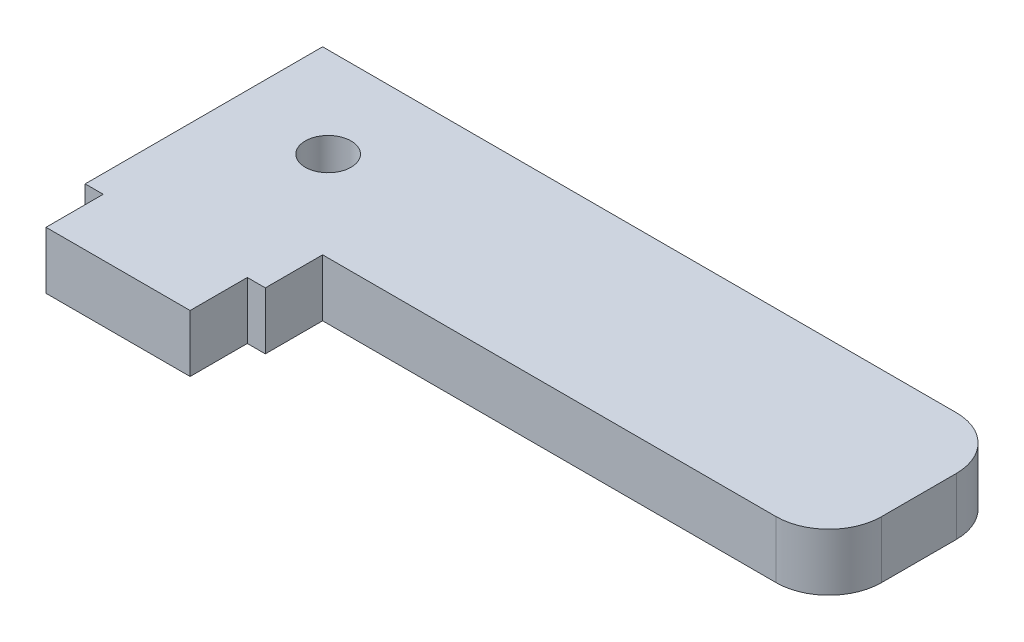
from build123d import *

# Parameters (mm, degrees)
SKETCH1_R           = 1.27
BOSS_EXTRUDE1_DEPTH = 3.175
FILLET1_R           = 2.921
SKETCH2_W           = 1
SKETCH2_H           = 3.175
CUT_EXTRUDE1_DEPTH  = 42.583369873


with BuildPart() as part:
    # Sketch1 → Boss-Extrude1 (new body)
    with BuildSketch(Plane(origin=(0, 0, 0), x_dir=(1, 0, 0), z_dir=(0, 1, 0))):
        Polygon((0, 0), (0, 16.355), (38.1, 16.355), (38.1, 6.355), (10, 6.355), (10, 0), align=None)
        with Locations(Location((5.313, 11.35, 0), (0, 0, 270))):
            Circle(SKETCH1_R, mode=Mode.SUBTRACT)
    extrude(amount=BOSS_EXTRUDE1_DEPTH)

    # Fillet1
    fillet1_edges = [part.edges().sort_by_distance(p)[0] for p in [
        (38.1, 1.5875, -16.355),
        (38.1, 1.5875, -6.355),
    ]]
    fillet(fillet1_edges, radius=FILLET1_R)

    # Sketch2 → Cut-Extrude1 (cut, through all)
    with BuildSketch(Plane(origin=(0, 3.175, 0), x_dir=(1, 0, 0), z_dir=(0, 1, 0))):
        with Locations((9.5, 1.5875)):
            Rectangle(SKETCH2_W, SKETCH2_H)
        with Locations((0.5, 1.5875)):
            Rectangle(SKETCH2_W, SKETCH2_H)
    extrude(amount=-CUT_EXTRUDE1_DEPTH, mode=Mode.SUBTRACT)


solid = part.part
